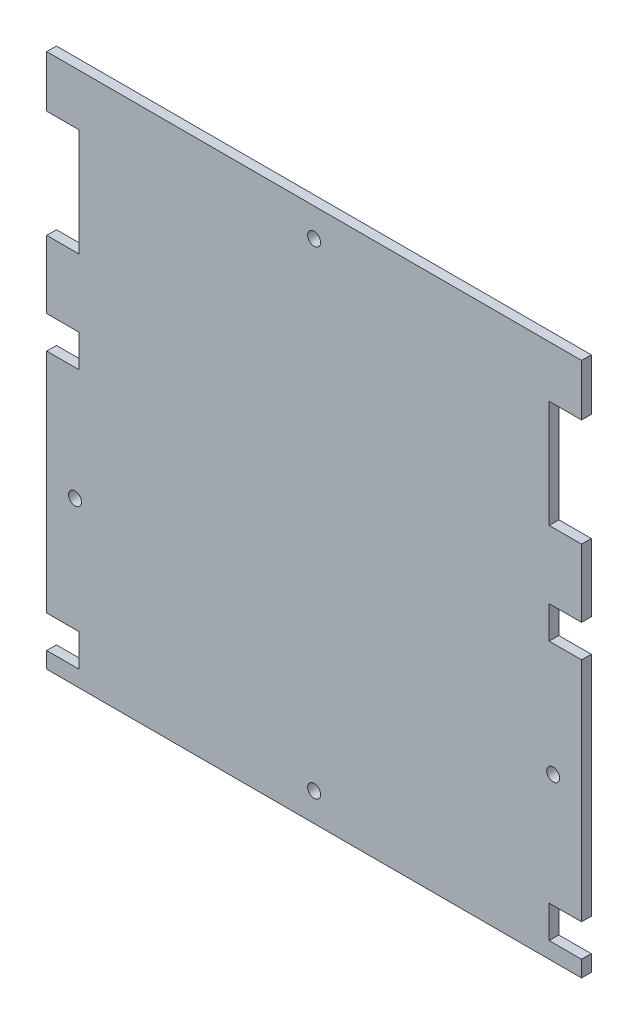
from build123d import *

# Parameters (mm, degrees)
ESQUISSE1_R        = 2
BOSS_EXTRU_1_DEPTH = 3


with BuildPart() as part:
    # Esquisse1 → Boss.-Extru.1 (new body)
    with BuildSketch(Plane.XY):
        Polygon((-89.706165703, -247.5), (75.293834297, -247.5), (75.293834297, -242.5), (65.293834297, -242.5), (65.293834297, -232.5), (75.293834297, -232.5), (75.293834297, -162.5), (65.293834297, -162.5), (65.293834297, -152.5), (75.293834297, -152.5), (75.293834297, -131.583123952), (65.293834297, -131.583123952), (65.293834297, -98.416876048), (75.293834297, -98.416876048), (75.293834297, -82.5), (-89.706165703, -82.5), (-89.706165703, -98.416876048), (-79.706165703, -98.416876048), (-79.706165703, -131.583123952), (-89.706165703, -131.583123952), (-89.706165703, -152.5), (-79.706165703, -152.5), (-79.706165703, -162.5), (-89.706165703, -162.5), (-89.706165703, -232.5), (-79.706165703, -232.5), (-79.706165703, -242.5), (-89.706165703, -242.5), align=None)
        with Locations((-7.206165703, -91.25)):
            Circle(ESQUISSE1_R, mode=Mode.SUBTRACT)
        with Locations((-80.956165703, -197.5)):
            Circle(ESQUISSE1_R, mode=Mode.SUBTRACT)
        with Locations((-7.206165703, -238.75)):
            Circle(ESQUISSE1_R, mode=Mode.SUBTRACT)
        with Locations((66.543834297, -197.5)):
            Circle(ESQUISSE1_R, mode=Mode.SUBTRACT)
    extrude(amount=BOSS_EXTRU_1_DEPTH)


solid = part.part
